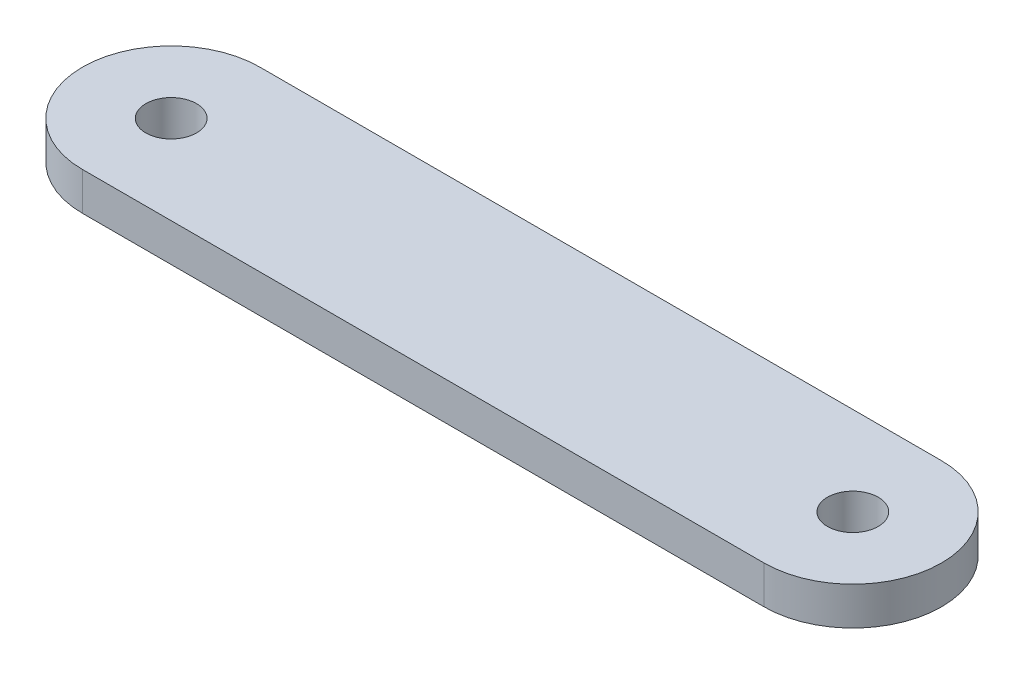
from build123d import *

# Parameters (mm, degrees)
SKETCH1_R           = 2.005
BOSS_EXTRUDE1_DEPTH = 3


with BuildPart() as part:
    # Sketch1 → Boss-Extrude1 (new body)
    with BuildSketch(Plane(origin=(0, 0, 0), x_dir=(1, 0, 0), z_dir=(0, 1, 0))):
        with BuildLine():
            Line((-26.905, 7), (26.905, 7))
            ThreePointArc((26.905, 7), (33.905, 0), (26.905, -7))
            Line((26.905, -7), (-26.905, -7))
            ThreePointArc((-26.905, -7), (-33.905, 0), (-26.905, 7))
        make_face()
        with Locations(Location((-26.905, 0, 0), (0, 0, 270))):
            Circle(SKETCH1_R, mode=Mode.SUBTRACT)
        with Locations(Location((26.905, 0, 0), (0, 0, 270))):
            Circle(SKETCH1_R, mode=Mode.SUBTRACT)
    extrude(amount=BOSS_EXTRUDE1_DEPTH)


solid = part.part
